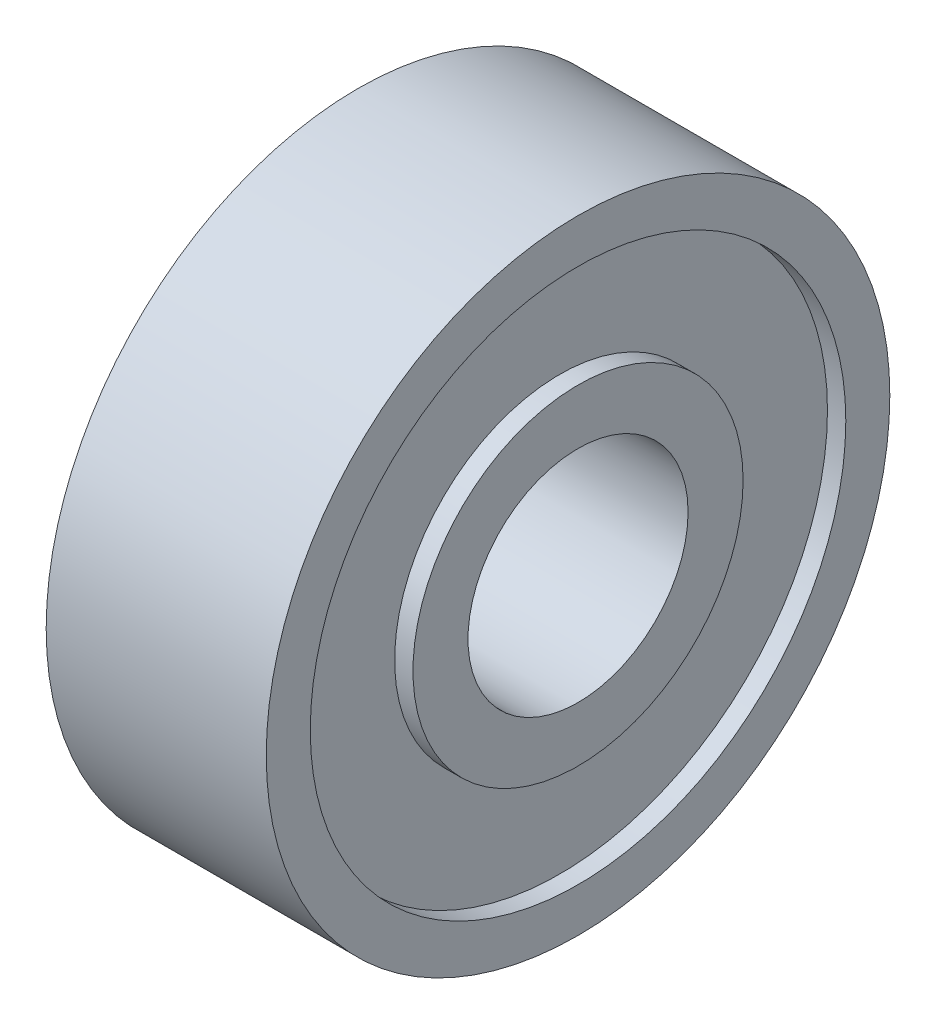
from build123d import *


with BuildPart() as part:
    # Croquis2 → Revolución1 (revolve)
    with BuildSketch(Plane.XY, mode=Mode.PRIVATE) as revoluci_n1_sk:
        Polygon((3, 7.3), (3, 8.5), (0, 8.5), (0, 3), (3, 3), (3, 4.5), (2.5, 4.5), (2.5, 7.3), align=None)
        Polygon((0, 3), (0, 8.5), (-3, 8.5), (-3, 7.3), (-2.5, 7.3), (-2.5, 4.5), (-3, 4.5), (-3, 3), align=None)
    revolve(revoluci_n1_sk.sketch.rotate(Axis((6.771887169, 0, 0), (-1, 0, 0)), 90), axis=Axis((6.771887169, 0, 0), (-1, 0, 0)))


solid = part.part
